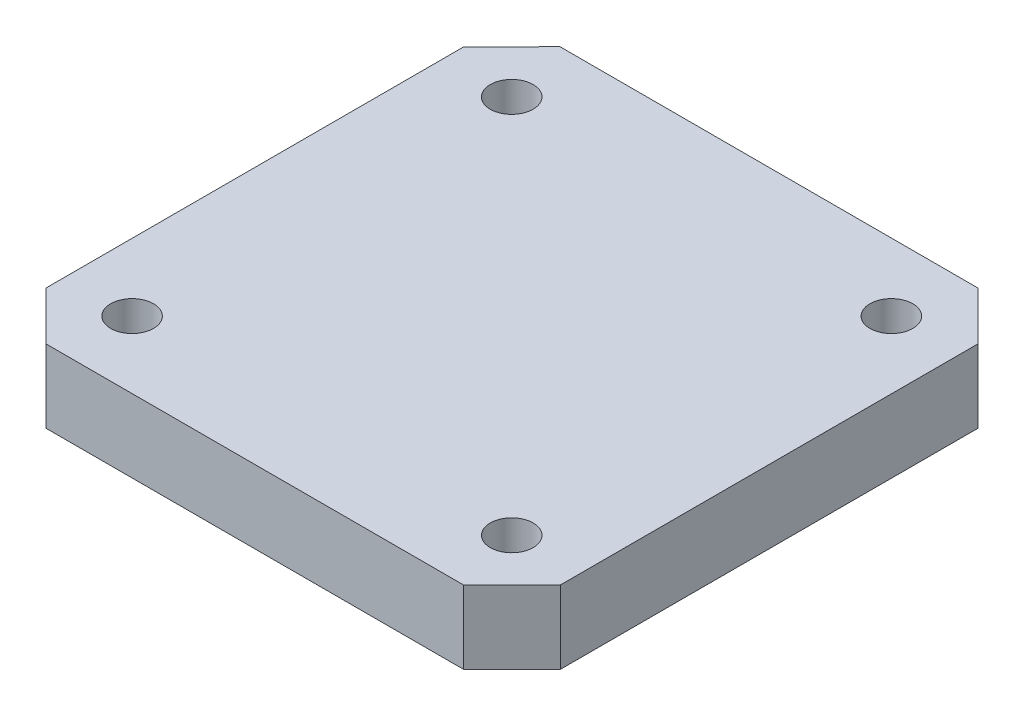
from build123d import *

# Parameters (mm, degrees)
BOSS_EXTRUDE1_DEPTH = 5.969
SKETCH2_R           = 1.75
SKETCH2_R_2         = 1.750000056
CUT_EXTRUDE1_DEPTH  = 5.969


with BuildPart() as part:
    # Sketch1 → Boss-Extrude1 (new body)
    with BuildSketch(Plane(origin=(0, 0, 0), x_dir=(1, 0, 0), z_dir=(0, 1, 0))):
        Polygon((3.909848904, 42), (0, 38.007654129), (0, 3.951224), (3.951224, 0), (38.048776, 0), (42, 3.951224), (42, 38.054127921), (38.043254173, 42), align=None)
    extrude(amount=BOSS_EXTRUDE1_DEPTH)

    # Sketch2 → Cut-Extrude1 (cut)
    with BuildSketch(Plane(origin=(0, 5.969, 0), x_dir=(1, 0, 0), z_dir=(0, 1, 0))):
        with Locations(Location((5.5, 36.479439065, 0), (0, 0, 270))):
            Circle(SKETCH2_R)
        with Locations(Location((36.5, 36.479439065, 0), (0, 0, 270))):
            Circle(SKETCH2_R_2)
        with Locations(Location((36.5, 5.479439065, 0), (0, 0, 270))):
            Circle(SKETCH2_R_2)
        with Locations(Location((5.5, 5.479439065, 0), (0, 0, 270))):
            Circle(SKETCH2_R_2)
    extrude(amount=-CUT_EXTRUDE1_DEPTH, mode=Mode.SUBTRACT)


solid = part.part
